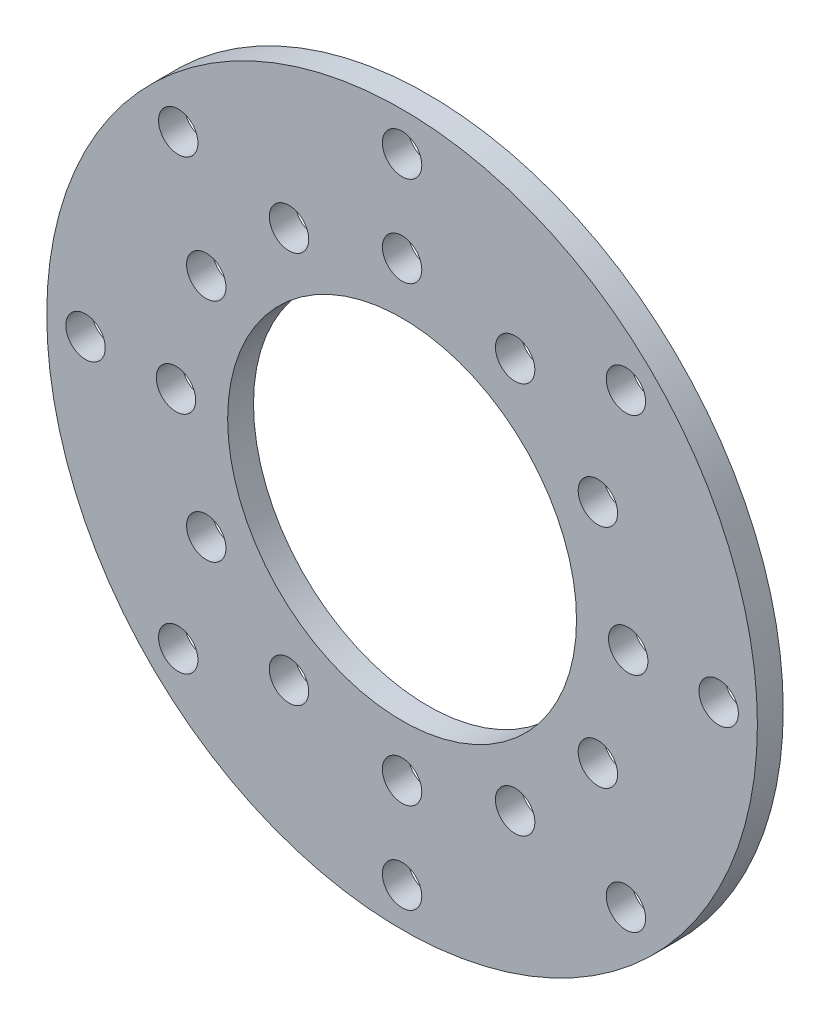
from build123d import *

# Parameters (mm, degrees)
SKETCH_1_R          = 27.5
SKETCH_1_R_2        = 13.5
EXTRUDE_1_DEPTH     = 2
SKETCH_2_R          = 1.525
CUT_EXTRUDE_1_DEPTH = 2
SKETCH_3_R          = 1.525
CUT_EXTRUDE_2_DEPTH = 2


with BuildPart() as part:
    # 草图1 → 凸台-拉伸1 (new body)
    with BuildSketch(Plane.XY):
        Circle(SKETCH_1_R)
        Circle(SKETCH_1_R_2, mode=Mode.SUBTRACT)
    extrude(amount=EXTRUDE_1_DEPTH)

    # 草图2 → 切除-拉伸1 (cut)
    with BuildSketch(Plane.XY.offset(2)):
        with Locations((0, 17.5)):
            Circle(SKETCH_2_R)
        with Locations((8.75, 15.155444566)):
            Circle(SKETCH_2_R)
        with Locations((15.155444566, 8.75)):
            Circle(SKETCH_2_R)
        with Locations((17.5, 0)):
            Circle(SKETCH_2_R)
        with Locations((15.155444566, -8.75)):
            Circle(SKETCH_2_R)
        with Locations((8.75, -15.155444566)):
            Circle(SKETCH_2_R)
        with Locations((0, -17.5)):
            Circle(SKETCH_2_R)
        with Locations((-8.75, -15.155444566)):
            Circle(SKETCH_2_R)
        with Locations((-15.155444566, -8.75)):
            Circle(SKETCH_2_R)
        with Locations((-17.5, 0)):
            Circle(SKETCH_2_R)
        with Locations((-15.155444566, 8.75)):
            Circle(SKETCH_2_R)
        with Locations((-8.75, 15.155444566)):
            Circle(SKETCH_2_R)
    extrude(amount=-CUT_EXTRUDE_1_DEPTH, mode=Mode.SUBTRACT)

    # 草图3 → 切除-拉伸2 (cut)
    with BuildSketch(Plane.XY.offset(2)):
        with Locations((0, 24.5)):
            Circle(SKETCH_3_R)
        with Locations((17.324116139, 17.324116139)):
            Circle(SKETCH_3_R)
        with Locations((24.5, 0)):
            Circle(SKETCH_3_R)
        with Locations((17.324116139, -17.324116139)):
            Circle(SKETCH_3_R)
        with Locations((0, -24.5)):
            Circle(SKETCH_3_R)
        with Locations((-17.324116139, -17.324116139)):
            Circle(SKETCH_3_R)
        with Locations((-24.5, 0)):
            Circle(SKETCH_3_R)
        with Locations((-17.324116139, 17.324116139)):
            Circle(SKETCH_3_R)
    extrude(amount=-CUT_EXTRUDE_2_DEPTH, mode=Mode.SUBTRACT)


solid = part.part
